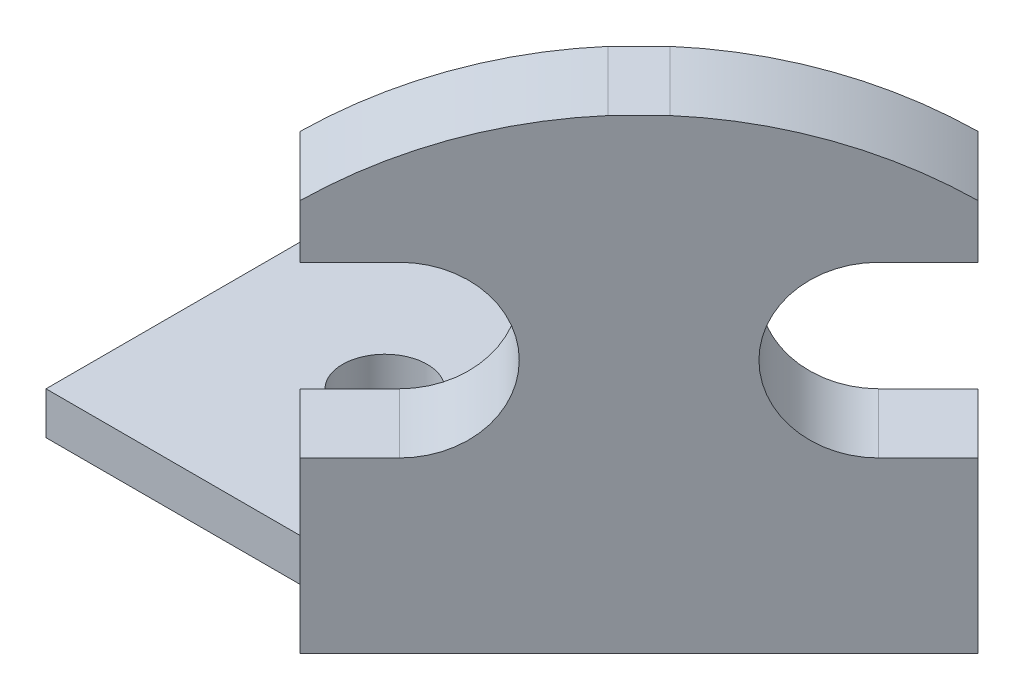
from build123d import *

# Parameters (mm, degrees)
SKETCH1_R               = 10
BOSS_EXTRUDE1_DEPTH     = 10
BOSS_EXTRUDE2_DEPTH     = 110
CUT_EXTRUDE2_DEPTH      = 200.025801938
CUT_EXTRUDE2_DEPTH_BACK = 110


with BuildPart() as part:
    # Sketch1 → Boss-Extrude1 (new body)
    with BuildSketch(Plane(origin=(0, 0, 0), x_dir=(1, 0, 0), z_dir=(0, 1, 0))):
        Polygon((0, 80), (0, 0), (60, 0), (140, 80), align=None)
        with Locations((40, 40)):
            Circle(SKETCH1_R, mode=Mode.SUBTRACT)
    extrude(amount=BOSS_EXTRUDE1_DEPTH)

    # Sketch1<3> → Boss-Extrude2 (add)
    with BuildSketch(Plane(origin=(0, 0, 0), x_dir=(1, 0, 0), z_dir=(0, 1, 0))):
        Polygon((140, 80), (60, 0), (74.142135624, -14.142135624), (154.142135624, 65.857864376), align=None)
    extrude(amount=BOSS_EXTRUDE2_DEPTH)

    # Sketch2 → Cut-Extrude2 (cut, two sides: drawn at the far end of the back side and taken through both)
    with BuildSketch(Plane(origin=(44.142135624, 0, 44.142135624), x_dir=(0.7071067811865461, 0, -0.707106781186549), z_dir=(0.707106781186549, 0, 0.7071067811865461)).offset(-CUT_EXTRUDE2_DEPTH_BACK)):
        with BuildLine():
            Line((58.994949366, 80), (42.426406871, 80))
            Line((42.426406871, 80), (42.426406871, 40))
            Line((42.426406871, 40), (58.994949366, 40))
            ThreePointArc((58.994949366, 40), (78.994949366, 60), (58.994949366, 80))
        make_face()
        with BuildLine():
            Line((42.426406871, 110), (42.426406871, 92.625413423))
            ThreePointArc((42.426406871, 92.625413423), (66.915884537, 104.857221881), (93.802749132, 110))
            Line((93.802749132, 110), (42.426406871, 110))
        make_face()
        with BuildLine():
            Line((155.563491861, 40), (155.563491861, 80))
            Line((155.563491861, 80), (138.994949366, 80))
            ThreePointArc((138.994949366, 80), (118.994949366, 60), (138.994949366, 40))
            Line((138.994949366, 40), (155.563491861, 40))
        make_face()
        with BuildLine():
            Line((155.563491861, 110), (104.1871496, 110))
            ThreePointArc((104.1871496, 110), (131.074014195, 104.857221881), (155.563491861, 92.625413423))
            Line((155.563491861, 92.625413423), (155.563491861, 110))
        make_face()
    extrude(amount=CUT_EXTRUDE2_DEPTH + CUT_EXTRUDE2_DEPTH_BACK, mode=Mode.SUBTRACT)


solid = part.part
